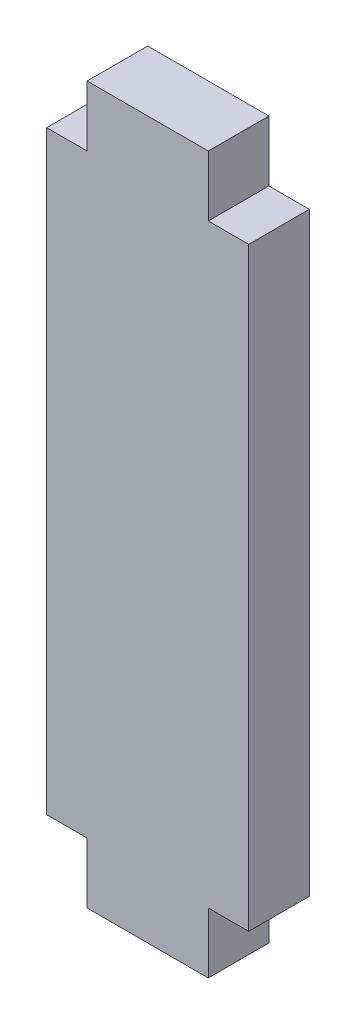
from build123d import *

# Parameters (mm, degrees)
SKETCH1_W           = 10
SKETCH1_H           = 29.45
SKETCH1_W_2         = 6
SKETCH1_H_2         = 3
BOSS_EXTRUDE1_DEPTH = 3


with BuildPart() as part:
    # Sketch1 → Boss-Extrude1 (new body)
    with BuildSketch(Plane.XY):
        Rectangle(SKETCH1_W, SKETCH1_H)
        with Locations((0, 16.225)):
            Rectangle(SKETCH1_W_2, SKETCH1_H_2)
        with Locations((0, -16.225)):
            Rectangle(SKETCH1_W_2, SKETCH1_H_2)
    extrude(amount=BOSS_EXTRUDE1_DEPTH)


solid = part.part
